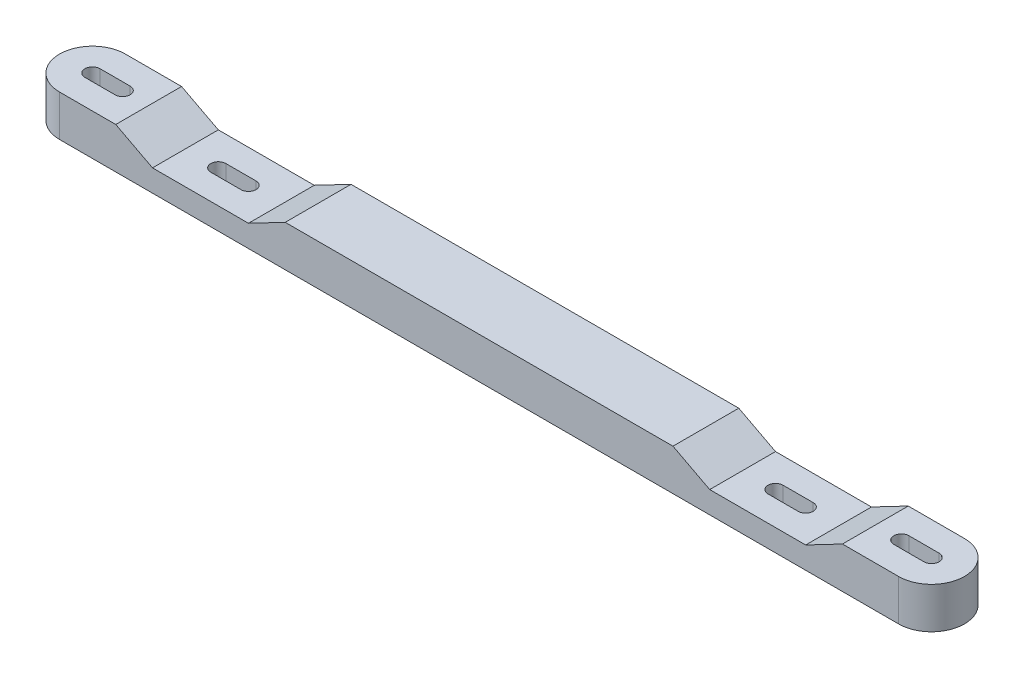
from build123d import *

# Parameters (mm, degrees)
BOSS_EXTRUDE2_DEPTH = 15
CUT_EXTRUDE3_DEPTH  = 168.40967714


with BuildPart() as part:
    # Sketch1 → Boss-Extrude2 (new body)
    with BuildSketch(Plane(origin=(0, 0, 0), x_dir=(1, 0, 0), z_dir=(0, 1, 0))):
        with BuildLine():
            Line((-153, 113.6), (153, 113.6))
            ThreePointArc((153, 113.6), (165, 101.6), (153, 89.6))
            Line((153, 89.6), (-153, 89.6))
            ThreePointArc((-153, 89.6), (-165, 101.6), (-153, 113.6))
        make_face()
        with BuildLine():
            Line((-153, 104.35), (-142, 104.35))
            ThreePointArc((-142, 104.35), (-139.25, 101.6), (-142, 98.85))
            Line((-142, 98.85), (-153, 98.85))
            ThreePointArc((-153, 98.85), (-155.75, 101.6), (-153, 104.35))
        make_face(mode=Mode.SUBTRACT)
        with BuildLine():
            Line((-107.1, 104.35), (-96.1, 104.35))
            ThreePointArc((-96.1, 104.35), (-93.35, 101.6), (-96.1, 98.85))
            Line((-96.1, 98.85), (-107.1, 98.85))
            ThreePointArc((-107.1, 98.85), (-109.85, 101.6), (-107.1, 104.35))
        make_face(mode=Mode.SUBTRACT)
        with BuildLine():
            Line((96.1, 104.35), (107.1, 104.35))
            ThreePointArc((107.1, 104.35), (109.85, 101.6), (107.1, 98.85))
            Line((107.1, 98.85), (96.1, 98.85))
            ThreePointArc((96.1, 98.85), (93.35, 101.6), (96.1, 104.35))
        make_face(mode=Mode.SUBTRACT)
        with BuildLine():
            Line((153, 98.85), (142, 98.85))
            ThreePointArc((142, 98.85), (139.25, 101.6), (142, 104.35))
            Line((142, 104.35), (153, 104.35))
            ThreePointArc((153, 104.35), (155.75, 101.6), (153, 98.85))
        make_face(mode=Mode.SUBTRACT)
    extrude(amount=BOSS_EXTRUDE2_DEPTH)

    # Sketch4 → Cut-Extrude3 (cut, through all)
    with BuildSketch(Plane.XY.offset(-89.6)):
        Polygon((-132.5, 15), (-119.1, 8), (-84.1, 8), (-70.7, 15), align=None)
        Polygon((119.1, 8), (132.5, 15), (70.7, 15), (84.1, 8), align=None)
    extrude(amount=-CUT_EXTRUDE3_DEPTH, mode=Mode.SUBTRACT)


solid = part.part
